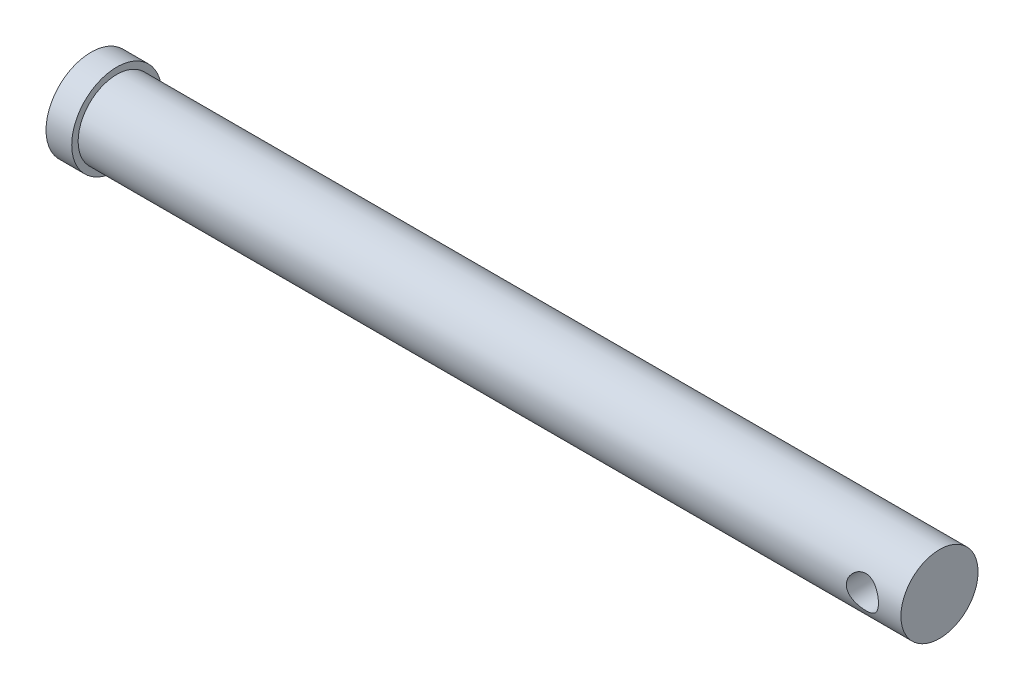
from build123d import *

# Parameters (mm, degrees)
IZIM2_R               = 12.5
KES_EKSTR_ZYON1_DEPTH = 30


with BuildPart() as part:
    # Çizim1 → Döndür1 (revolve)
    with BuildSketch(Plane.XY, mode=Mode.PRIVATE) as d_nd_r1_sk:
        Polygon((0, 0), (0, 35), (20, 35), (20, 30), (660, 30), (660, 0), align=None)
    revolve(d_nd_r1_sk.sketch.rotate(Axis((0, 0, 0), (1, 0, 0)), 90), axis=Axis((0, 0, 0), (1, 0, 0)))

    # Çizim2 → Kes-Ekstrüzyon1 (cut, symmetric)
    with BuildSketch(Plane.XY):
        with Locations((630, 0)):
            Circle(IZIM2_R)
    extrude(amount=KES_EKSTR_ZYON1_DEPTH, both=True, mode=Mode.SUBTRACT)


solid = part.part
